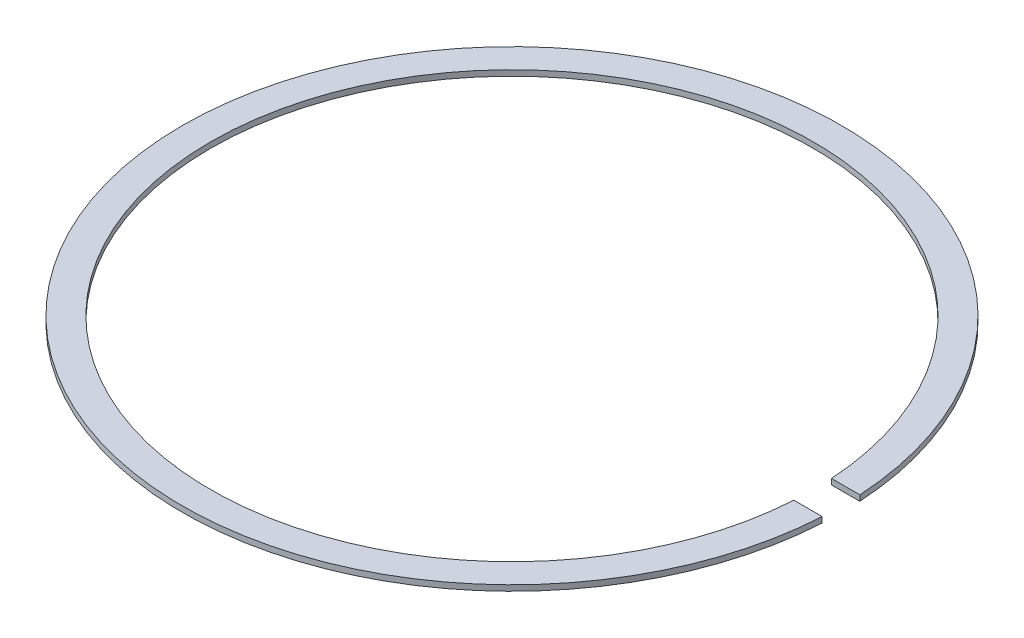
from build123d import *

# Parameters (mm, degrees)
SKETCH1_R           = 175
SKETCH1_R_2         = 160
BOSS_EXTRUDE1_DEPTH = 1.5
AXIS_GAP_DEPTH      = 248.49191906
AXIS_GAP_DEPTH_BACK = 248.49191906
SKETCH2_W           = 32.609126468
SKETCH2_H           = 20


with BuildPart() as part:
    # Sketch1 → Boss-Extrude1 (new, symmetric)
    with BuildSketch(Plane(origin=(0, 0, 0), x_dir=(1, 0, 0), z_dir=(0, 1, 0))):
        with Locations(Location((0, 0, 0), (0, 0, 270))):
            Circle(SKETCH1_R)
        with Locations(Location((0, 0, 0), (0, 0, 270))):
            Circle(SKETCH1_R_2, mode=Mode.SUBTRACT)
    extrude(amount=BOSS_EXTRUDE1_DEPTH, both=True)

    # Sketch2 → axis gap (cut, two sides: drawn at the far end of the back side and taken through both)
    with BuildSketch(Plane(origin=(0, 0, 0), x_dir=(1, 0, 0), z_dir=(0, 1, 0)).offset(-AXIS_GAP_DEPTH_BACK)):
        with Locations((167.5, 0)):
            Rectangle(SKETCH2_W, SKETCH2_H)
    extrude(amount=AXIS_GAP_DEPTH + AXIS_GAP_DEPTH_BACK, mode=Mode.SUBTRACT)


solid = part.part
